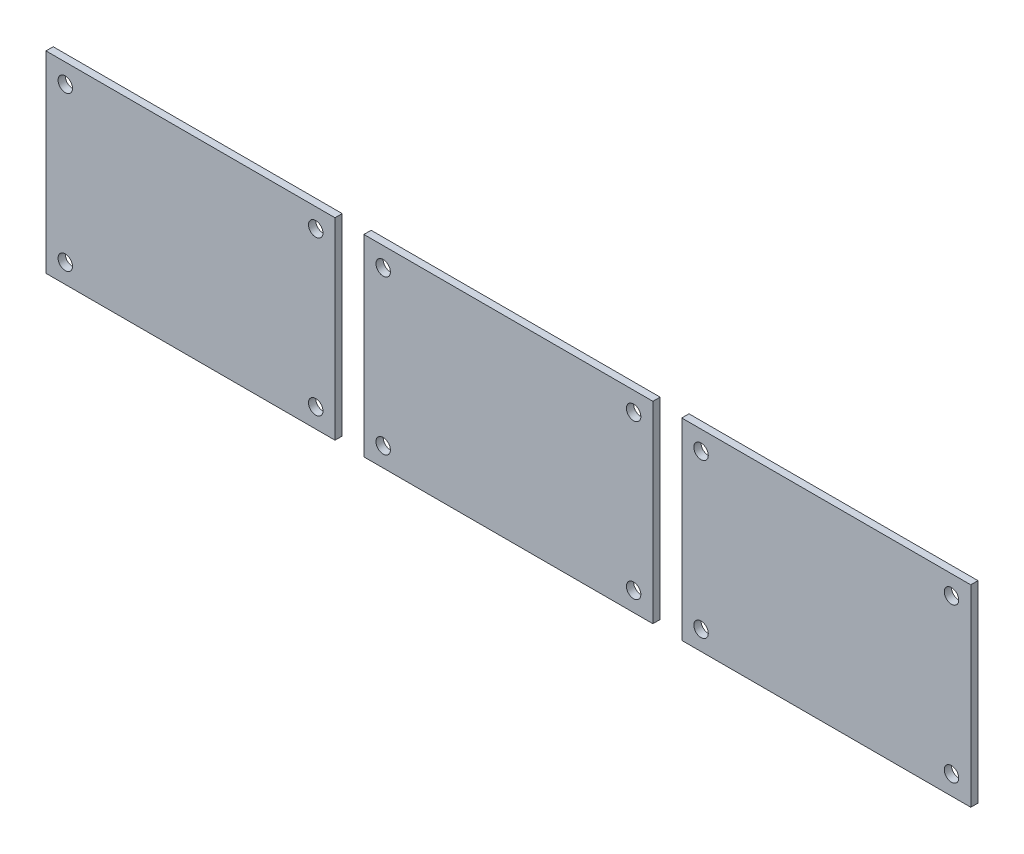
from build123d import *

# Parameters (mm, degrees)
SKETCH_1_W        = 60
SKETCH_1_H        = 40
SKETCH_1_R        = 1.5
EXTRUDE_1_DEPTH   = 1.5
EXTRUDE_1_2_DEPTH = 1.5
EXTRUDE_1_3_DEPTH = 1.5


with BuildPart() as part:
    # Эскиз1 → Бобышка-Вытянуть1 (new body)
    with BuildSketch(Plane.XY):
        with Locations((96, 20)):
            Rectangle(SKETCH_1_W, SKETCH_1_H)
        with Locations((70, 36)):
            Circle(SKETCH_1_R, mode=Mode.SUBTRACT)
        with Locations((122, 36)):
            Circle(SKETCH_1_R, mode=Mode.SUBTRACT)
        with Locations((122, 4)):
            Circle(SKETCH_1_R, mode=Mode.SUBTRACT)
        with Locations((70, 4)):
            Circle(SKETCH_1_R, mode=Mode.SUBTRACT)
    extrude(amount=EXTRUDE_1_DEPTH)


with BuildPart() as body_2:
    # Эскиз1 → Extrude 1 2 (new body)
    with BuildSketch(Plane.XY):
        with Locations((30, 20)):
            Rectangle(SKETCH_1_W, SKETCH_1_H)
        with Locations((4, 4)):
            Circle(SKETCH_1_R, mode=Mode.SUBTRACT)
        with Locations((56, 4)):
            Circle(SKETCH_1_R, mode=Mode.SUBTRACT)
        with Locations((56, 36)):
            Circle(SKETCH_1_R, mode=Mode.SUBTRACT)
        with Locations((4, 36)):
            Circle(SKETCH_1_R, mode=Mode.SUBTRACT)
    extrude(amount=EXTRUDE_1_2_DEPTH)


with BuildPart() as body_3:
    # Эскиз1 → Extrude 1 3 (new body)
    with BuildSketch(Plane.XY):
        with Locations((162, 20)):
            Rectangle(SKETCH_1_W, SKETCH_1_H)
        with Locations((136, 36)):
            Circle(SKETCH_1_R, mode=Mode.SUBTRACT)
        with Locations((188, 36)):
            Circle(SKETCH_1_R, mode=Mode.SUBTRACT)
        with Locations((188, 4)):
            Circle(SKETCH_1_R, mode=Mode.SUBTRACT)
        with Locations((136, 4)):
            Circle(SKETCH_1_R, mode=Mode.SUBTRACT)
    extrude(amount=EXTRUDE_1_3_DEPTH)


solid = Compound([part.part, body_2.part, body_3.part])
